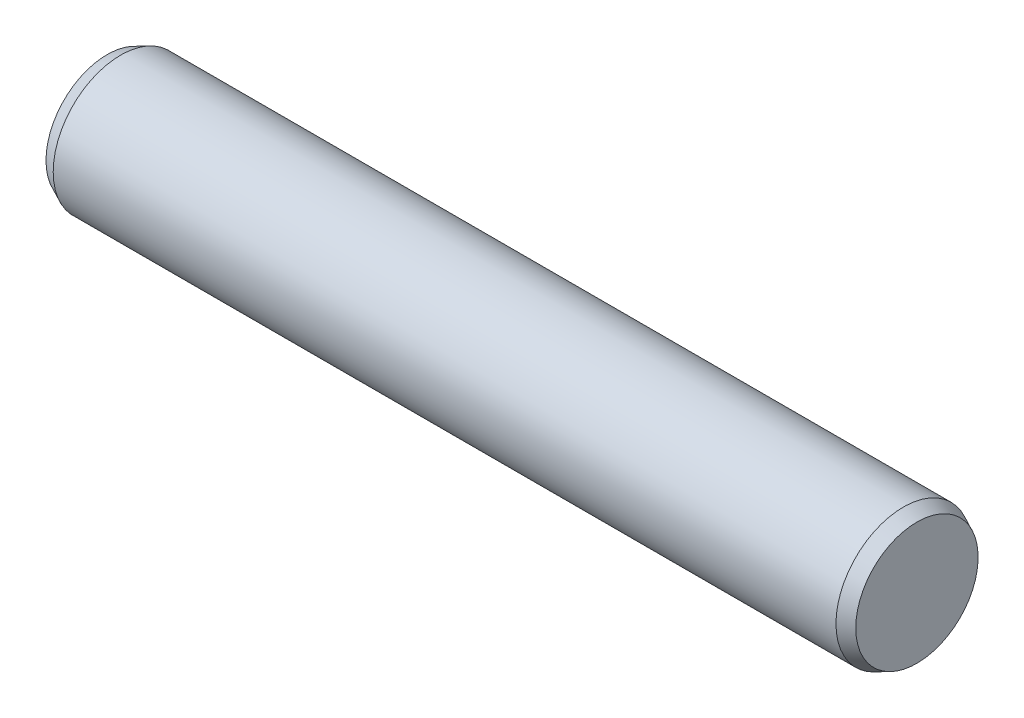
from build123d import *


with BuildPart() as part:
    # Sketch1 → Base-Revolve (revolve)
    with BuildSketch(Plane.XY, mode=Mode.PRIVATE) as base_revolve_sk:
        Polygon((0, 0), (38.1, 0), (38.1, 2.878894637), (37.465, 3.175), (0.635, 3.175), (0, 2.878894637), align=None)
    revolve(base_revolve_sk.sketch.rotate(Axis((-6.35, 0, 0), (1, 0, 0)), 90), axis=Axis((-6.35, 0, 0), (1, 0, 0)))


solid = part.part
